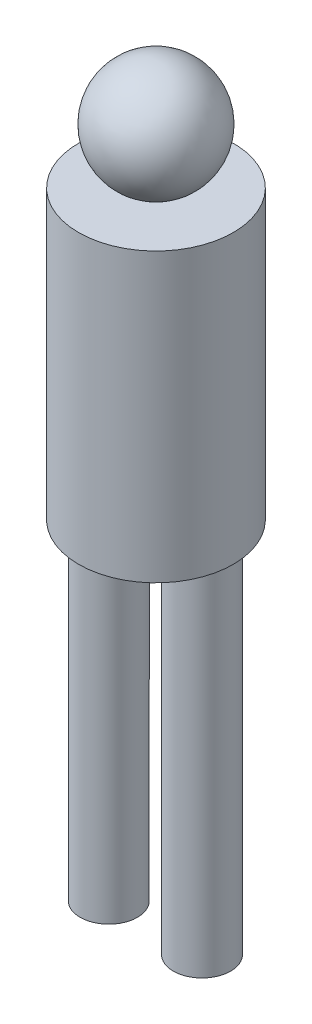
from build123d import *

# Parameters (mm, degrees)
SKETCH1_R           = 177.8
BOSS_EXTRUDE1_DEPTH = 660.4
SKETCH3_R           = 65.813617278
BOSS_EXTRUDE2_DEPTH = 812.8


with BuildPart() as part:
    # Sketch1 → Boss-Extrude1 (new body)
    with BuildSketch(Plane(origin=(0, 0, 0), x_dir=(1, 0, 0), z_dir=(0, 1, 0))):
        with Locations(Location((0, 0, 0), (0, 0, 270))):
            Circle(SKETCH1_R)
    extrude(amount=BOSS_EXTRUDE1_DEPTH)

    # Sketch3 → Boss-Extrude2 (add)
    with BuildSketch(Plane(origin=(0, 0, 0), x_dir=(-1, 0, 0), z_dir=(0, -1, 0))):
        with Locations(Location((108.384656073, 0, 0), (0, 0, 270))):
            Circle(SKETCH3_R)
        with Locations(Location((-105.835290589, 0, 0), (0, 0, 270))):
            Circle(SKETCH3_R)
    extrude(amount=BOSS_EXTRUDE2_DEPTH)


with BuildPart() as body_2:
    # Sketch2 → Revolve1 (revolve)
    with BuildSketch(Plane(origin=(0, 0, 0), x_dir=(0, 0, -1), z_dir=(1, 0, 0))):
        with BuildLine():
            Line((0, 914.4), (0, 660.4))
            ThreePointArc((0, 660.4), (127, 787.4), (0, 914.4))
        make_face()
    revolve(axis=Axis((0, 660.4, 0), (0, 1, 0)))


solid = Compound([part.part, body_2.part])
